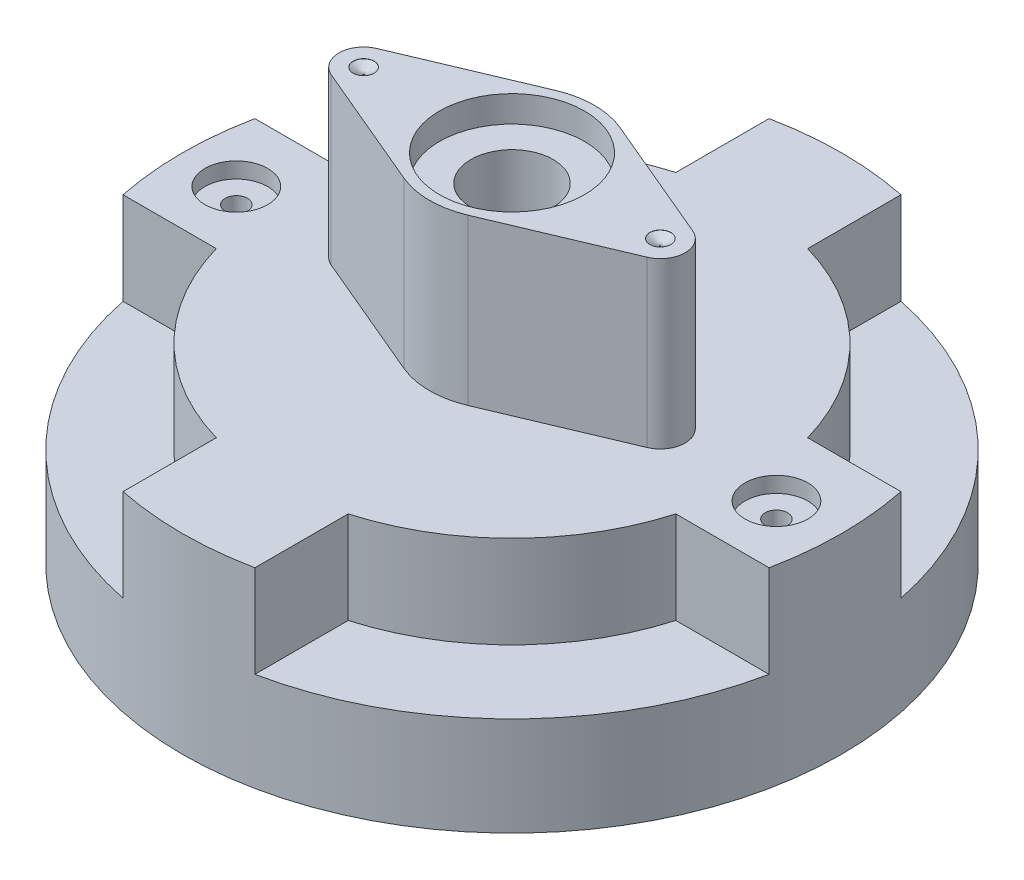
from build123d import *

# Parameters (mm, degrees)
SKETCH2_R                                = 100
BOSS_EXTRUDE1_DEPTH                      = 30
BOSS_EXTRUDE2_DEPTH                      = 28
BOSS_EXTRUDE3_DEPTH                      = 50
CBORE_FOR_1_4_HEX_HEAD_BOLT1_D           = 6.7564
CBORE_FOR_1_4_HEX_HEAD_BOLT1_CBORE_D     = 19.05
CBORE_FOR_1_4_HEX_HEAD_BOLT1_CBORE_DEPTH = 4.7752


with BuildPart() as part:
    # Sketch2 → Boss-Extrude1 (new body)
    with BuildSketch(Plane(origin=(0, 0, 0), x_dir=(1, 0, 0), z_dir=(0, 1, 0))):
        with Locations(Location((0, 0, 0), (0, 0, 270))):
            Circle(SKETCH2_R)
    extrude(amount=BOSS_EXTRUDE1_DEPTH)

    # Sketch3 → Boss-Extrude2 (add)
    with BuildSketch(Plane(origin=(0, 30, 0), x_dir=(1, 0, 0), z_dir=(0, 1, 0))):
        with BuildLine():
            ThreePointArc((20, 97.979589711), (0, 100), (-20, 97.979589711))
            Line((-20, 97.979589711), (-20, 69.686799324))
            ThreePointArc((-20, 69.686799324), (-51.265241636, 51.265241636), (-69.686799324, 20))
            Line((-69.686799324, 20), (-97.979589711, 20))
            ThreePointArc((-97.979589711, 20), (-100, 0), (-97.979589711, -20))
            Line((-97.979589711, -20), (-69.686799324, -20))
            ThreePointArc((-69.686799324, -20), (-51.265241636, -51.265241636), (-20, -69.686799324))
            Line((-20, -69.686799324), (-20, -97.979589711))
            ThreePointArc((-20, -97.979589711), (0, -100), (20, -97.979589711))
            Line((20, -97.979589711), (20, -69.686799324))
            ThreePointArc((20, -69.686799324), (51.265241636, -51.265241636), (69.686799324, -20))
            Line((69.686799324, -20), (97.979589711, -20))
            ThreePointArc((97.979589711, -20), (99.493615301, -10.050896201), (100, 0))
            ThreePointArc((100, 0), (99.493615301, 10.050896201), (97.979589711, 20))
            Line((97.979589711, 20), (69.686799324, 20))
            ThreePointArc((69.686799324, 20), (51.265241636, 51.265241636), (20, 69.686799324))
            Line((20, 69.686799324), (20, 97.979589711))
        make_face()
    extrude(amount=BOSS_EXTRUDE2_DEPTH)

    # Sketch4 → Boss-Extrude3 (add)
    with BuildSketch(Plane(origin=(0, 58, 0), x_dir=(1, 0, 0), z_dir=(0, 1, 0))):
        with BuildLine():
            Line((-9.722222222, 23.0321166), (-47.916666667, 6.90963498))
            ThreePointArc((-47.916666667, 6.90963498), (-52.5, 0), (-47.916666667, -6.90963498))
            Line((-47.916666667, -6.90963498), (-9.722222222, -23.0321166))
            ThreePointArc((-9.722222222, -23.0321166), (0, -25), (9.722222222, -23.0321166))
            Line((9.722222222, -23.0321166), (47.916666667, -6.90963498))
            ThreePointArc((47.916666667, -6.90963498), (52.5, 0), (47.916666667, 6.90963498))
            Line((47.916666667, 6.90963498), (9.722222222, 23.0321166))
            ThreePointArc((9.722222222, 23.0321166), (0, 25), (-9.722222222, 23.0321166))
        make_face()
    extrude(amount=BOSS_EXTRUDE3_DEPTH)

    # CBORE for 1/4 Hex Head Bolt1 (through all)
    with Locations(Plane(origin=(-82.955537588, 58, 0.659036268), x_dir=(0, 0, 1), z_dir=(0, 1, 0))):
        with Locations((0, 0), (0.670356689, 164.496030798)):
            CounterBoreHole(CBORE_FOR_1_4_HEX_HEAD_BOLT1_D / 2, CBORE_FOR_1_4_HEX_HEAD_BOLT1_CBORE_D / 2, CBORE_FOR_1_4_HEX_HEAD_BOLT1_CBORE_DEPTH)

    # Sketch8 → 1/4 (0.25) Diameter Hole1 (revolve, cut)
    with BuildSketch(Plane(origin=(-45, 108, 0), x_dir=(0, 0, 1), z_dir=(1, 0, 0))):
        Polygon((0, 0), (0, 1.957732465), (3.175, 0.05), (3.175, 0), align=None)
    f_1_4_0_25_diameter_hole1 = revolve(axis=Axis((-45, 114.35, 0), (0, -1, 0)), mode=Mode.SUBTRACT)

    # Mirror1: 1/4 (0.25) Diameter Hole1 across plane
    add(f_1_4_0_25_diameter_hole1.mirror(Plane(origin=(0, 0, 0), x_dir=(0, 0, 1), z_dir=(1, 0, 0))), mode=Mode.SUBTRACT)

    # Sketch9 → Cut-Revolve1 (revolve, cut)
    with BuildSketch(Plane.XY, mode=Mode.PRIVATE) as cut_revolve1_sk:
        with BuildLine():
            Line((0, 108), (-22, 108))
            Line((-22, 108), (-22, 100))
            Line((-22, 100), (-12.5, 100))
            Line((-12.5, 100), (-12.5, 62))
            Line((-12.5, 62), (-5, 62))
            Line((-5, 62), (-5, 49))
            Line((-5, 49), (-15.789877929, 49))
            ThreePointArc((-15.789877929, 49), (-24.423738044, 45.423738044), (-28, 36.789877929))
            Line((-28, 36.789877929), (-28, 25))
            Line((-28, 25), (-40, 25))
            Line((-40, 25), (-40, 0))
            Line((-40, 0), (0, 0))
            Line((0, 0), (0, 108))
        make_face()
    revolve(cut_revolve1_sk.sketch.rotate(Axis((0, 0, 0), (0, 1, 0)), 270), axis=Axis((0, 0, 0), (0, 1, 0)), mode=Mode.SUBTRACT)


solid = part.part
